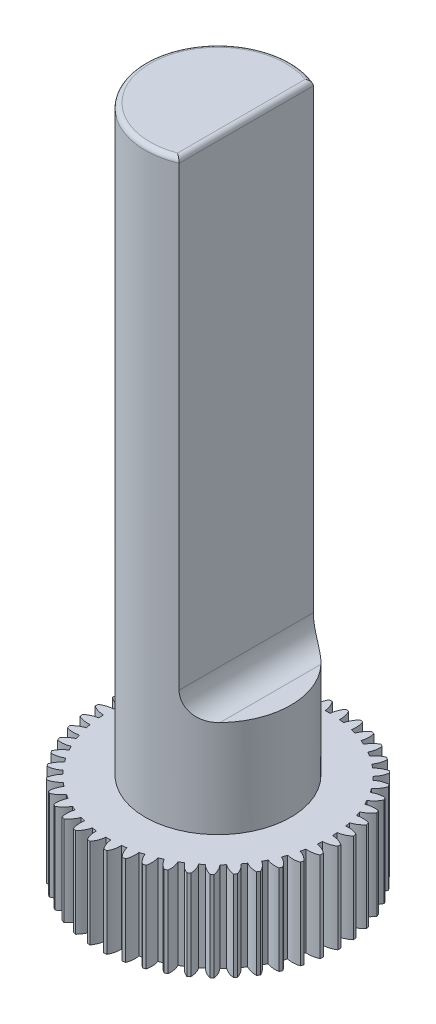
from build123d import *

# Parameters (mm, degrees)
BOSS_EXTRUDE1_DEPTH = 1.85
SKETCH2_R           = 0.5
CUT_EXTRUDE1_DEPTH  = 1
SKETCH3_R           = 1.5
BOSS_EXTRUDE2_DEPTH = 12
SKETCH4_W           = 1.135603044
SKETCH4_H           = 3.445522871
CUT_EXTRUDE2_DEPTH  = 10
REDONDEO1_R         = 0.5
REDONDEO2_R         = 0.1


with BuildPart() as part:
    # Sketch1 → Boss-Extrude1 (new body)
    with BuildSketch(Plane(origin=(0, 0, 0), x_dir=(1, 0, 0), z_dir=(0, 1, 0))):
        with BuildLine():
            ThreePointArc((-2.119954941, 1.325062658), (-2.136048511, 1.298959875), (-2.151820698, 1.272661654))
            ThreePointArc((-2.151820698, 1.272661654), (-2.080635644, 1.166512098), (-1.983126195, 1.083886754))
            ThreePointArc((-1.983126195, 1.083886754), (-2.006620594, 1.039746985), (-2.029132698, 0.995098232))
            ThreePointArc((-2.029132698, 0.995098232), (-2.152866897, 1.027112107), (-2.280638908, 1.024053793))
            ThreePointArc((-2.280638908, 1.024053793), (-2.293028254, 0.996002725), (-2.305072596, 0.967801801))
            ThreePointArc((-2.305072596, 0.967801801), (-2.220096534, 0.872333958), (-2.112244478, 0.803755726))
            ThreePointArc((-2.112244478, 0.803755726), (-2.129509684, 0.756827924), (-2.145732439, 0.709529634))
            ThreePointArc((-2.145732439, 0.709529634), (-2.272673393, 0.724396858), (-2.398838888, 0.703968742))
            ThreePointArc((-2.398838888, 0.703968742), (-2.407293218, 0.674491928), (-2.415385354, 0.644913631))
            ThreePointArc((-2.415385354, 0.644913631), (-2.318201228, 0.561905887), (-2.202015642, 0.508652249))
            ThreePointArc((-2.202015642, 0.508652249), (-2.212730038, 0.459810589), (-2.222361244, 0.41074384))
            ThreePointArc((-2.222361244, 0.41074384), (-2.350144283, 0.408187466), (-2.472353038, 0.370770087))
            ThreePointArc((-2.472353038, 0.370770087), (-2.476714865, 0.340416623), (-2.480704053, 0.310011941))
            ThreePointArc((-2.480704053, 0.310011941), (-2.373122218, 0.241010572), (-2.250767422, 0.204073543))
            ThreePointArc((-2.250767422, 0.204073543), (-2.254731418, 0.154227854), (-2.257591664, 0.104306666))
            ThreePointArc((-2.257591664, 0.104306666), (-2.383836431, 0.084374314), (-2.499811928, 0.030664685))
            ThreePointArc((-2.499811928, 0.030664685), (-2.5, 0), (-2.499811928, -0.030664685))
            ThreePointArc((-2.499811928, -0.030664685), (-2.383836431, -0.084374314), (-2.257591664, -0.104306666))
            ThreePointArc((-2.257591664, -0.104306666), (-2.254731418, -0.154227854), (-2.250767422, -0.204073543))
            ThreePointArc((-2.250767422, -0.204073543), (-2.373122218, -0.241010572), (-2.480704053, -0.310011941))
            ThreePointArc((-2.480704053, -0.310011941), (-2.476714865, -0.340416623), (-2.472353038, -0.370770087))
            ThreePointArc((-2.472353038, -0.370770087), (-2.350144283, -0.408187466), (-2.222361244, -0.41074384))
            ThreePointArc((-2.222361244, -0.41074384), (-2.212730038, -0.459810589), (-2.202015642, -0.508652249))
            ThreePointArc((-2.202015642, -0.508652249), (-2.318201228, -0.561905887), (-2.415385354, -0.644913631))
            ThreePointArc((-2.415385354, -0.644913631), (-2.407293218, -0.674491928), (-2.398838888, -0.703968742))
            ThreePointArc((-2.398838888, -0.703968742), (-2.272673393, -0.724396858), (-2.145732439, -0.709529634))
            ThreePointArc((-2.145732439, -0.709529634), (-2.129509684, -0.756827924), (-2.112244478, -0.803755726))
            ThreePointArc((-2.112244478, -0.803755726), (-2.220096534, -0.872333958), (-2.305072596, -0.967801801))
            ThreePointArc((-2.305072596, -0.967801801), (-2.293028254, -0.996002725), (-2.280638908, -1.024053793))
            ThreePointArc((-2.280638908, -1.024053793), (-2.152866897, -1.027112107), (-2.029132698, -0.995098232))
            ThreePointArc((-2.029132698, -0.995098232), (-2.006620594, -1.039746985), (-1.983126195, -1.083886754))
            ThreePointArc((-1.983126195, -1.083886754), (-2.080635644, -1.166512098), (-2.151820698, -1.272661654))
            ThreePointArc((-2.151820698, -1.272661654), (-2.136048511, -1.298959875), (-2.119954941, -1.325062658))
            ThreePointArc((-2.119954941, -1.325062658), (-1.992956565, -1.3106942), (-1.874734055, -1.262130034))
            ThreePointArc((-1.874734055, -1.262130034), (-1.846351958, -1.303297528), (-1.817066023, -1.343827023))
            ThreePointArc((-1.817066023, -1.343827023), (-1.902416447, -1.438960325), (-1.958484451, -1.553814228))
            ThreePointArc((-1.958484451, -1.553814228), (-1.939278227, -1.577719861), (-1.919780224, -1.601388114))
            ThreePointArc((-1.919780224, -1.601388114), (-1.795921223, -1.569860541), (-1.685412664, -1.505650741))
            ThreePointArc((-1.685412664, -1.505650741), (-1.651689279, -1.542570104), (-1.617157349, -1.578734337))
            ThreePointArc((-1.617157349, -1.578734337), (-1.688758832, -1.684603444), (-1.728665344, -1.806022184))
            ThreePointArc((-1.728665344, -1.806022184), (-1.706382858, -1.827089911), (-1.683843634, -1.847882739))
            ThreePointArc((-1.683843634, -1.847882739), (-1.565431266, -1.79978335), (-1.464695223, -1.721124023))
            ThreePointArc((-1.464695223, -1.721124023), (-1.426258754, -1.753107517), (-1.387124094, -1.784232818))
            ThreePointArc((-1.387124094, -1.784232818), (-1.443642835, -1.898865588), (-1.466644473, -2.024587363))
            ThreePointArc((-1.466644473, -2.024587363), (-1.441700805, -2.042424733), (-1.416540223, -2.059954804))
            ThreePointArc((-1.416540223, -2.059954804), (-1.305780287, -1.996179601), (-1.216693282, -1.904536022))
            ThreePointArc((-1.216693282, -1.904536022), (-1.174259727, -1.930987854), (-1.131251341, -1.956494417))
            ThreePointArc((-1.131251341, -1.956494417), (-1.171634504, -2.077755459), (-1.17730279, -2.20543831))
            ThreePointArc((-1.17730279, -2.20543831), (-1.150162594, -2.219713046), (-1.122849348, -2.23365381))
            ThreePointArc((-1.122849348, -2.23365381), (-1.021805092, -2.155390803), (-0.946026647, -2.052470118))
            ThreePointArc((-0.946026647, -2.052470118), (-0.900386463, -2.072897541), (-0.854305516, -2.092310227))
            ThreePointArc((-0.854305516, -2.092310227), (-0.877800839, -2.217940677), (-0.866030184, -2.345206115))
            ThreePointArc((-0.866030184, -2.345206115), (-0.83719903, -2.355652305), (-0.808241914, -2.365744071))
            ThreePointArc((-0.808241914, -2.365744071), (-0.718795601, -2.274451152), (-0.657737325, -2.162170579))
            ThreePointArc((-0.657737325, -2.162170579), (-0.609740703, -2.176193069), (-0.561445596, -2.189150256))
            ThreePointArc((-0.561445596, -2.189150256), (-0.567615404, -2.316809856), (-0.538625074, -2.441287167))
            ThreePointArc((-0.538625074, -2.441287167), (-0.508640033, -2.447710219), (-0.478578463, -2.453764996))
            ThreePointArc((-0.478578463, -2.453764996), (-0.402396308, -2.351142779), (-0.357195602, -2.231593893))
            ThreePointArc((-0.357195602, -2.231593893), (-0.307736627, -2.238950238), (-0.258127007, -2.245210558))
            ThreePointArc((-0.258127007, -2.245210558), (-0.246856369, -2.372521252), (-0.201186398, -2.491891658))
            ThreePointArc((-0.201186398, -2.491891658), (-0.170606033, -2.494171923), (-0.14, -2.496076922))
            ThreePointArc((-0.14, -2.496076922), (-0.078501133, -2.384037065), (-0.05, -2.259446835))
            ThreePointArc((-0.05, -2.259446835), (0, -2.26), (0.05, -2.259446835))
            ThreePointArc((0.05, -2.259446835), (0.078501133, -2.384037065), (0.14, -2.496076922))
            ThreePointArc((0.14, -2.496076922), (0.170606033, -2.494171923), (0.201186398, -2.491891658))
            ThreePointArc((0.201186398, -2.491891658), (0.246856369, -2.372521252), (0.258127007, -2.245210558))
            ThreePointArc((0.258127007, -2.245210558), (0.307736627, -2.238950238), (0.357195602, -2.231593893))
            ThreePointArc((0.357195602, -2.231593893), (0.402396308, -2.351142779), (0.478578463, -2.453764996))
            ThreePointArc((0.478578463, -2.453764996), (0.508640033, -2.447710219), (0.538625074, -2.441287167))
            ThreePointArc((0.538625074, -2.441287167), (0.567615404, -2.316809856), (0.561445596, -2.189150256))
            ThreePointArc((0.561445596, -2.189150256), (0.609740703, -2.176193069), (0.657737325, -2.162170579))
            ThreePointArc((0.657737325, -2.162170579), (0.718795601, -2.274451152), (0.808241914, -2.365744071))
            ThreePointArc((0.808241914, -2.365744071), (0.83719903, -2.355652305), (0.866030184, -2.345206115))
            ThreePointArc((0.866030184, -2.345206115), (0.877800839, -2.217940677), (0.854305516, -2.092310227))
            ThreePointArc((0.854305516, -2.092310227), (0.900386463, -2.072897541), (0.946026647, -2.052470118))
            ThreePointArc((0.946026647, -2.052470118), (1.021805092, -2.155390803), (1.122849348, -2.23365381))
            ThreePointArc((1.122849348, -2.23365381), (1.150162594, -2.219713046), (1.17730279, -2.20543831))
            ThreePointArc((1.17730279, -2.20543831), (1.171634504, -2.077755459), (1.131251341, -1.956494417))
            ThreePointArc((1.131251341, -1.956494417), (1.174259727, -1.930987854), (1.216693282, -1.904536022))
            ThreePointArc((1.216693282, -1.904536022), (1.305780287, -1.996179601), (1.416540223, -2.059954804))
            ThreePointArc((1.416540223, -2.059954804), (1.441700805, -2.042424733), (1.466644473, -2.024587363))
            ThreePointArc((1.466644473, -2.024587363), (1.443642835, -1.898865588), (1.387124094, -1.784232818))
            ThreePointArc((1.387124094, -1.784232818), (1.426258754, -1.753107517), (1.464695223, -1.721124023))
            ThreePointArc((1.464695223, -1.721124023), (1.565431266, -1.79978335), (1.683843634, -1.847882739))
            ThreePointArc((1.683843634, -1.847882739), (1.706382858, -1.827089911), (1.728665344, -1.806022184))
            ThreePointArc((1.728665344, -1.806022184), (1.688758832, -1.684603444), (1.617157349, -1.578734337))
            ThreePointArc((1.617157349, -1.578734337), (1.651689279, -1.542570104), (1.685412664, -1.505650741))
            ThreePointArc((1.685412664, -1.505650741), (1.795921223, -1.569860541), (1.919780224, -1.601388114))
            ThreePointArc((1.919780224, -1.601388114), (1.939278227, -1.577719861), (1.958484451, -1.553814228))
            ThreePointArc((1.958484451, -1.553814228), (1.902416447, -1.438960325), (1.817066023, -1.343827023))
            ThreePointArc((1.817066023, -1.343827023), (1.846351958, -1.303297528), (1.874734055, -1.262130034))
            ThreePointArc((1.874734055, -1.262130034), (1.992956565, -1.3106942), (2.119954941, -1.325062658))
            ThreePointArc((2.119954941, -1.325062658), (2.136048511, -1.298959875), (2.151820698, -1.272661654))
            ThreePointArc((2.151820698, -1.272661654), (2.080635644, -1.166512098), (1.983126195, -1.083886754))
            ThreePointArc((1.983126195, -1.083886754), (2.006620594, -1.039746985), (2.029132698, -0.995098232))
            ThreePointArc((2.029132698, -0.995098232), (2.152866897, -1.027112107), (2.280638908, -1.024053793))
            ThreePointArc((2.280638908, -1.024053793), (2.293028254, -0.996002725), (2.305072596, -0.967801801))
            ThreePointArc((2.305072596, -0.967801801), (2.220096534, -0.872333958), (2.112244478, -0.803755726))
            ThreePointArc((2.112244478, -0.803755726), (2.129509684, -0.756827924), (2.145732439, -0.709529634))
            ThreePointArc((2.145732439, -0.709529634), (2.272673393, -0.724396858), (2.398838888, -0.703968742))
            ThreePointArc((2.398838888, -0.703968742), (2.407293218, -0.674491928), (2.415385354, -0.644913631))
            ThreePointArc((2.415385354, -0.644913631), (2.318201228, -0.561905887), (2.202015642, -0.508652249))
            ThreePointArc((2.202015642, -0.508652249), (2.212730038, -0.459810589), (2.222361244, -0.41074384))
            ThreePointArc((2.222361244, -0.41074384), (2.350144283, -0.408187466), (2.472353038, -0.370770087))
            ThreePointArc((2.472353038, -0.370770087), (2.476714865, -0.340416623), (2.480704053, -0.310011941))
            ThreePointArc((2.480704053, -0.310011941), (2.373122218, -0.241010572), (2.250767422, -0.204073543))
            ThreePointArc((2.250767422, -0.204073543), (2.254731418, -0.154227854), (2.257591664, -0.104306666))
            ThreePointArc((2.257591664, -0.104306666), (2.383836431, -0.084374314), (2.499811928, -0.030664685))
            ThreePointArc((2.499811928, -0.030664685), (2.5, 0), (2.499811928, 0.030664685))
            ThreePointArc((2.499811928, 0.030664685), (2.383836431, 0.084374314), (2.257591664, 0.104306666))
            ThreePointArc((2.257591664, 0.104306666), (2.254731418, 0.154227854), (2.250767422, 0.204073543))
            ThreePointArc((2.250767422, 0.204073543), (2.373122218, 0.241010572), (2.480704053, 0.310011941))
            ThreePointArc((2.480704053, 0.310011941), (2.476714865, 0.340416623), (2.472353038, 0.370770087))
            ThreePointArc((2.472353038, 0.370770087), (2.350144283, 0.408187466), (2.222361244, 0.41074384))
            ThreePointArc((2.222361244, 0.41074384), (2.212730038, 0.459810589), (2.202015642, 0.508652249))
            ThreePointArc((2.202015642, 0.508652249), (2.318201228, 0.561905887), (2.415385354, 0.644913631))
            ThreePointArc((2.415385354, 0.644913631), (2.407293218, 0.674491928), (2.398838888, 0.703968742))
            ThreePointArc((2.398838888, 0.703968742), (2.272673393, 0.724396858), (2.145732439, 0.709529634))
            ThreePointArc((2.145732439, 0.709529634), (2.129509684, 0.756827924), (2.112244478, 0.803755726))
            ThreePointArc((2.112244478, 0.803755726), (2.220096534, 0.872333958), (2.305072596, 0.967801801))
            ThreePointArc((2.305072596, 0.967801801), (2.293028254, 0.996002725), (2.280638908, 1.024053793))
            ThreePointArc((2.280638908, 1.024053793), (2.152866897, 1.027112107), (2.029132698, 0.995098232))
            ThreePointArc((2.029132698, 0.995098232), (2.006620594, 1.039746985), (1.983126195, 1.083886754))
            ThreePointArc((1.983126195, 1.083886754), (2.080635644, 1.166512098), (2.151820698, 1.272661654))
            ThreePointArc((2.151820698, 1.272661654), (2.136048511, 1.298959875), (2.119954941, 1.325062658))
            ThreePointArc((2.119954941, 1.325062658), (1.992956565, 1.3106942), (1.874734055, 1.262130034))
            ThreePointArc((1.874734055, 1.262130034), (1.846351958, 1.303297528), (1.817066023, 1.343827023))
            ThreePointArc((1.817066023, 1.343827023), (1.902416447, 1.438960325), (1.958484451, 1.553814228))
            ThreePointArc((1.958484451, 1.553814228), (1.939278227, 1.577719861), (1.919780224, 1.601388114))
            ThreePointArc((1.919780224, 1.601388114), (1.795921223, 1.569860541), (1.685412664, 1.505650741))
            ThreePointArc((1.685412664, 1.505650741), (1.651689279, 1.542570104), (1.617157349, 1.578734337))
            ThreePointArc((1.617157349, 1.578734337), (1.688758832, 1.684603444), (1.728665344, 1.806022184))
            ThreePointArc((1.728665344, 1.806022184), (1.706382858, 1.827089911), (1.683843634, 1.847882739))
            ThreePointArc((1.683843634, 1.847882739), (1.565431266, 1.79978335), (1.464695223, 1.721124023))
            ThreePointArc((1.464695223, 1.721124023), (1.426258754, 1.753107517), (1.387124094, 1.784232818))
            ThreePointArc((1.387124094, 1.784232818), (1.443642835, 1.898865588), (1.466644473, 2.024587363))
            ThreePointArc((1.466644473, 2.024587363), (1.441700805, 2.042424733), (1.416540223, 2.059954804))
            ThreePointArc((1.416540223, 2.059954804), (1.305780287, 1.996179601), (1.216693282, 1.904536022))
            ThreePointArc((1.216693282, 1.904536022), (1.174259727, 1.930987854), (1.131251341, 1.956494417))
            ThreePointArc((1.131251341, 1.956494417), (1.171634504, 2.077755459), (1.17730279, 2.20543831))
            ThreePointArc((1.17730279, 2.20543831), (1.150162594, 2.219713046), (1.122849348, 2.23365381))
            ThreePointArc((1.122849348, 2.23365381), (1.021805092, 2.155390803), (0.946026647, 2.052470118))
            ThreePointArc((0.946026647, 2.052470118), (0.900386463, 2.072897541), (0.854305516, 2.092310227))
            ThreePointArc((0.854305516, 2.092310227), (0.877800839, 2.217940677), (0.866030184, 2.345206115))
            ThreePointArc((0.866030184, 2.345206115), (0.83719903, 2.355652305), (0.808241914, 2.365744071))
            ThreePointArc((0.808241914, 2.365744071), (0.718795601, 2.274451152), (0.657737325, 2.162170579))
            ThreePointArc((0.657737325, 2.162170579), (0.609740703, 2.176193069), (0.561445596, 2.189150256))
            ThreePointArc((0.561445596, 2.189150256), (0.567615404, 2.316809856), (0.538625074, 2.441287167))
            ThreePointArc((0.538625074, 2.441287167), (0.508640033, 2.447710219), (0.478578463, 2.453764996))
            ThreePointArc((0.478578463, 2.453764996), (0.402396308, 2.351142779), (0.357195602, 2.231593893))
            ThreePointArc((0.357195602, 2.231593893), (0.307736627, 2.238950238), (0.258127007, 2.245210558))
            ThreePointArc((0.258127007, 2.245210558), (0.246856369, 2.372521252), (0.201186398, 2.491891658))
            ThreePointArc((0.201186398, 2.491891658), (0.170606033, 2.494171923), (0.14, 2.496076922))
            ThreePointArc((0.14, 2.496076922), (0.078501133, 2.384037065), (0.05, 2.259446835))
            ThreePointArc((0.05, 2.259446835), (0, 2.26), (-0.05, 2.259446835))
            ThreePointArc((-0.05, 2.259446835), (-0.078501133, 2.384037065), (-0.14, 2.496076922))
            ThreePointArc((-0.14, 2.496076922), (-0.170606033, 2.494171923), (-0.201186398, 2.491891658))
            ThreePointArc((-0.201186398, 2.491891658), (-0.246856369, 2.372521252), (-0.258127007, 2.245210558))
            ThreePointArc((-0.258127007, 2.245210558), (-0.307736627, 2.238950238), (-0.357195602, 2.231593893))
            ThreePointArc((-0.357195602, 2.231593893), (-0.402396308, 2.351142779), (-0.478578463, 2.453764996))
            ThreePointArc((-0.478578463, 2.453764996), (-0.508640033, 2.447710219), (-0.538625074, 2.441287167))
            ThreePointArc((-0.538625074, 2.441287167), (-0.567615404, 2.316809856), (-0.561445596, 2.189150256))
            ThreePointArc((-0.561445596, 2.189150256), (-0.609740703, 2.176193069), (-0.657737325, 2.162170579))
            ThreePointArc((-0.657737325, 2.162170579), (-0.718795601, 2.274451152), (-0.808241914, 2.365744071))
            ThreePointArc((-0.808241914, 2.365744071), (-0.83719903, 2.355652305), (-0.866030184, 2.345206115))
            ThreePointArc((-0.866030184, 2.345206115), (-0.877800839, 2.217940677), (-0.854305516, 2.092310227))
            ThreePointArc((-0.854305516, 2.092310227), (-0.900386463, 2.072897541), (-0.946026647, 2.052470118))
            ThreePointArc((-0.946026647, 2.052470118), (-1.021805092, 2.155390803), (-1.122849348, 2.23365381))
            ThreePointArc((-1.122849348, 2.23365381), (-1.150162594, 2.219713046), (-1.17730279, 2.20543831))
            ThreePointArc((-1.17730279, 2.20543831), (-1.171634504, 2.077755459), (-1.131251341, 1.956494417))
            ThreePointArc((-1.131251341, 1.956494417), (-1.174259727, 1.930987854), (-1.216693282, 1.904536022))
            ThreePointArc((-1.216693282, 1.904536022), (-1.305780287, 1.996179601), (-1.416540223, 2.059954804))
            ThreePointArc((-1.416540223, 2.059954804), (-1.441700805, 2.042424733), (-1.466644473, 2.024587363))
            ThreePointArc((-1.466644473, 2.024587363), (-1.443642835, 1.898865588), (-1.387124094, 1.784232818))
            ThreePointArc((-1.387124094, 1.784232818), (-1.426258754, 1.753107517), (-1.464695223, 1.721124023))
            ThreePointArc((-1.464695223, 1.721124023), (-1.565431266, 1.79978335), (-1.683843634, 1.847882739))
            ThreePointArc((-1.683843634, 1.847882739), (-1.706382858, 1.827089911), (-1.728665344, 1.806022184))
            ThreePointArc((-1.728665344, 1.806022184), (-1.688758832, 1.684603444), (-1.617157349, 1.578734337))
            ThreePointArc((-1.617157349, 1.578734337), (-1.651689279, 1.542570104), (-1.685412664, 1.505650741))
            ThreePointArc((-1.685412664, 1.505650741), (-1.795921223, 1.569860541), (-1.919780224, 1.601388114))
            ThreePointArc((-1.919780224, 1.601388114), (-1.939278227, 1.577719861), (-1.958484451, 1.553814228))
            ThreePointArc((-1.958484451, 1.553814228), (-1.902416447, 1.438960325), (-1.817066023, 1.343827023))
            ThreePointArc((-1.817066023, 1.343827023), (-1.846351958, 1.303297528), (-1.874734055, 1.262130034))
            ThreePointArc((-1.874734055, 1.262130034), (-1.992956565, 1.3106942), (-2.119954941, 1.325062658))
        make_face()
    extrude(amount=BOSS_EXTRUDE1_DEPTH)

    # Sketch2 → Cut-Extrude1 (cut)
    with BuildSketch(Plane.XZ):
        with Locations(Location((0, 0, 0), (0, 0, 270))):
            Circle(SKETCH2_R)
    extrude(amount=-CUT_EXTRUDE1_DEPTH, mode=Mode.SUBTRACT)

    # Sketch3 → Boss-Extrude2 (add)
    with BuildSketch(Plane(origin=(0, 1.85, 0), x_dir=(1, 0, 0), z_dir=(0, 1, 0))):
        with Locations(Location((0, 0, 0), (0, 0, 270))):
            Circle(SKETCH3_R)
    extrude(amount=BOSS_EXTRUDE2_DEPTH)

    # Sketch4 → Cut-Extrude2 (cut)
    with BuildSketch(Plane(origin=(0, 13.85, 0), x_dir=(1, 0, 0), z_dir=(0, 1, 0))):
        with Locations((1.148507624, -0.109688931)):
            Rectangle(SKETCH4_W, SKETCH4_H)
    extrude(amount=-CUT_EXTRUDE2_DEPTH, mode=Mode.SUBTRACT)

    # Redondeo1
    redondeo1_edges = [part.edges().sort_by_distance(p)[0] for p in [
        (0.580706102, 3.85, 0),
    ]]
    fillet(redondeo1_edges, radius=REDONDEO1_R)

    # Redondeo2
    redondeo2_edges = [part.edges().sort_by_distance(p)[0] for p in [
        (-1.470467541, 13.85, -0.29618442),
        (0.580706102, 13.85, 0),
    ]]
    fillet(redondeo2_edges, radius=REDONDEO2_R)


solid = part.part
